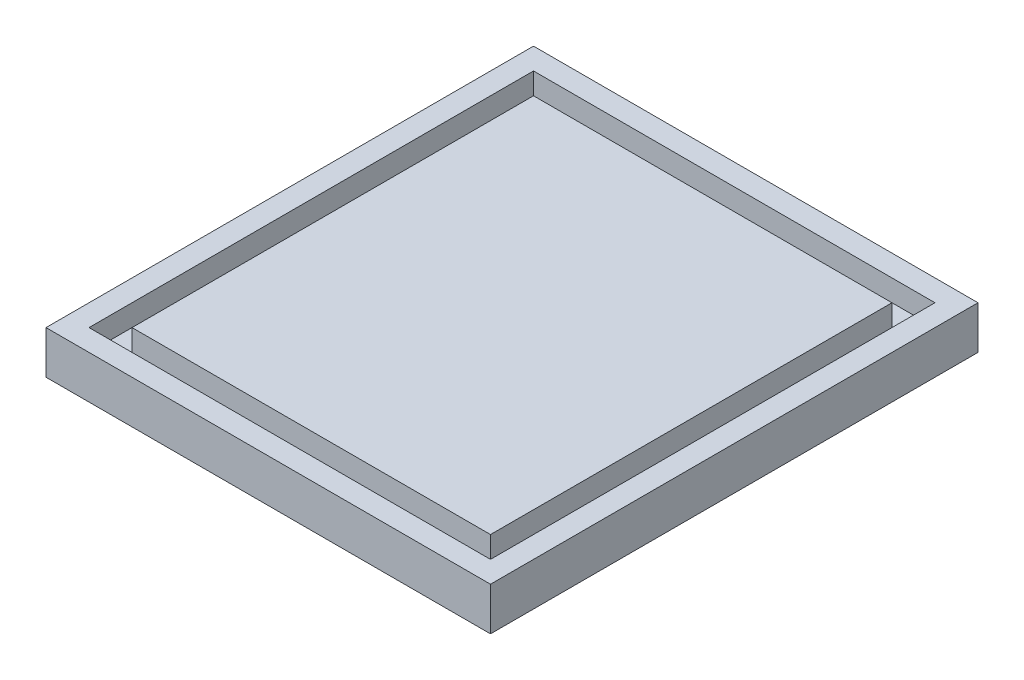
from build123d import *

# Parameters (mm, degrees)
SKETCH1_TURRETBODYPARENT_11_W   = 31
SKETCH1_TURRETBODYPARENT_11_H   = 34
BOSS_EXTRUDE1_DEPTH             = 1.5
SKETCH1_TURRETBODYPARENT_13_W   = 31
SKETCH1_TURRETBODYPARENT_13_H   = 34
SKETCH1_TURRETBODYPARENT_13_W_2 = 28
SKETCH1_TURRETBODYPARENT_13_H_2 = 31
SKETCH1_TURRETBODYPARENT_13_W_3 = 25
SKETCH1_TURRETBODYPARENT_13_H_3 = 28
BOSS_EXTRUDE2_DEPTH             = 1.5


with BuildPart() as part:
    # Sketch1-turretBodyParent<11> → Boss-Extrude1 (new body)
    with BuildSketch(Plane(origin=(0, 0, 0), x_dir=(1, 0, 0), z_dir=(0, 1, 0))):
        with Locations((11, 12.5)):
            Rectangle(SKETCH1_TURRETBODYPARENT_11_W, SKETCH1_TURRETBODYPARENT_11_H)
    extrude(amount=-BOSS_EXTRUDE1_DEPTH)

    # Sketch1-turretBodyParent<13> → Boss-Extrude2 (add)
    # profile 1 of 2: a face of its own
    with BuildSketch(Plane(origin=(0, 0, 0), x_dir=(1, 0, 0), z_dir=(0, 1, 0))):
        with Locations((11, 12.5)):
            Rectangle(SKETCH1_TURRETBODYPARENT_13_W, SKETCH1_TURRETBODYPARENT_13_H)
        with Locations((11, 12.5)):
            Rectangle(SKETCH1_TURRETBODYPARENT_13_W_2, SKETCH1_TURRETBODYPARENT_13_H_2, mode=Mode.SUBTRACT)
    # profile 2 of 2: a face of its own
    with BuildSketch(Plane(origin=(0, 0, 0), x_dir=(1, 0, 0), z_dir=(0, 1, 0))):
        with Locations((11, 12.5)):
            Rectangle(SKETCH1_TURRETBODYPARENT_13_W_3, SKETCH1_TURRETBODYPARENT_13_H_3)
    extrude(amount=BOSS_EXTRUDE2_DEPTH)


solid = part.part
